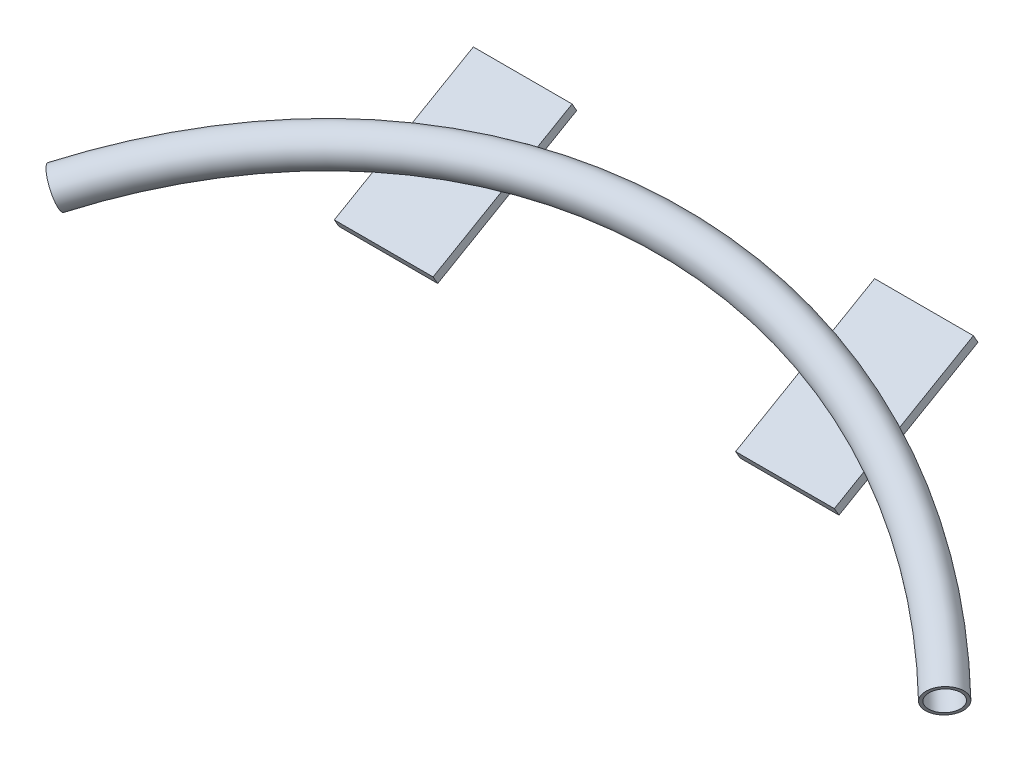
from build123d import *

# Parameters (mm, degrees)
SKETCH6_R        = 19.05
SKETCH6_R_2      = 15.875
SKETCH7_W        = 101.6
SKETCH7_H        = 165.1
EXTRUDE1_DEPTH   = 9.525
EXTRUDE1_2_DEPTH = 9.525


with BuildPart() as part:
    # Sweep2: sweep along a path in Sketch5
    with BuildLine(Plane(origin=(0, 0, 0), x_dir=(1, 0, 0), z_dir=(0, -0.8660254037844386, -0.4999999999999999))) as sweep2_path:
        ThreePointArc((-457.2, 0), (0, -203.2), (457.2, 0))
    # Sketch6 → Sweep2 (sweep)
    with BuildSketch(Plane(origin=(457.2, 0, 0), x_dir=(0.5623359865096149, -0.31144762329763287, -0.766014762402471), z_dir=(0.6701030927835051, -0.37113402061855666, 0.6428229801286556))):
        Circle(SKETCH6_R)
        Circle(SKETCH6_R_2, mode=Mode.SUBTRACT)
    sweep(path=sweep2_path.line)


with BuildPart() as body_2:
    # Sketch7 → Extrude1 (new body)
    with BuildSketch(Plane(origin=(0, -16.497783942, -9.525), x_dir=(1, 0, 0), z_dir=(0, -0.8660254037844387, -0.49999999999999983))):
        with Locations((-206.375, -171.45)):
            Rectangle(SKETCH7_W, SKETCH7_H)
    extrude(amount=EXTRUDE1_DEPTH)


with BuildPart() as body_3:
    # Sketch7 → Extrude1 2 (new body)
    with BuildSketch(Plane(origin=(0, -16.497783942, -9.525), x_dir=(1, 0, 0), z_dir=(0, -0.8660254037844387, -0.49999999999999983))):
        with Locations((206.375, -171.45)):
            Rectangle(SKETCH7_W, SKETCH7_H)
    extrude(amount=EXTRUDE1_2_DEPTH)


solid = Compound([part.part, body_2.part, body_3.part])
